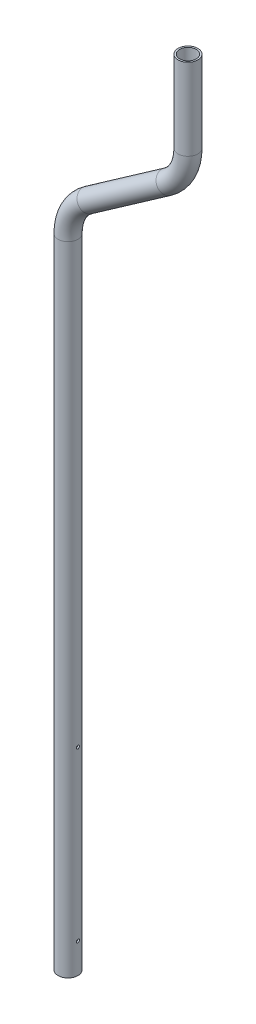
from build123d import *

# Parameters (mm, degrees)
SKETCH3_R               = 21.082
SKETCH3_R_2             = 17.526
CUT_EXTRUDE1_DEPTH      = 1828.519572572
CUT_EXTRUDE1_DEPTH_BACK = 1828.519572572
SKETCH5_R               = 3.3734375


with BuildPart() as part:
    # Sweep1: sweep along a path in Sketch2
    with BuildLine(Plane.XY) as sweep1_path:
        Line((0, 0), (0, 1350.407672959))
        ThreePointArc((0, 1350.407672959), (11.479699349, 1397.321332063), (43.324634067, 1433.633520658))
        Line((43.324634067, 1433.633520658), (210.675365933, 1550.813764636))
        ThreePointArc((210.675365933, 1550.813764636), (242.520300651, 1587.125953231), (254, 1634.039612336))
        Line((254, 1634.039612336), (254, 1806.575))
    # Sketch3 → Sweep1 (sweep)
    with BuildSketch(Plane(origin=(0, 1806.575, 0), x_dir=(1, 0, 0), z_dir=(0, 1, 0))):
        with Locations((254, 0)):
            Circle(SKETCH3_R)
        with Locations((254, 0)):
            Circle(SKETCH3_R_2, mode=Mode.SUBTRACT)
    sweep(path=sweep1_path.line)

    # Sketch5 → Cut-Extrude1 (cut, two sides: drawn at the far end of the back side and taken through both)
    with BuildSketch(Plane(origin=(0, 0, 0), x_dir=(0, 0, -1), z_dir=(1, 0, 0)).offset(-CUT_EXTRUDE1_DEPTH_BACK)):
        with Locations((0, 63.5)):
            Circle(SKETCH5_R)
        with Locations((0, 419.1)):
            Circle(SKETCH5_R)
    extrude(amount=CUT_EXTRUDE1_DEPTH + CUT_EXTRUDE1_DEPTH_BACK, mode=Mode.SUBTRACT)


solid = part.part
